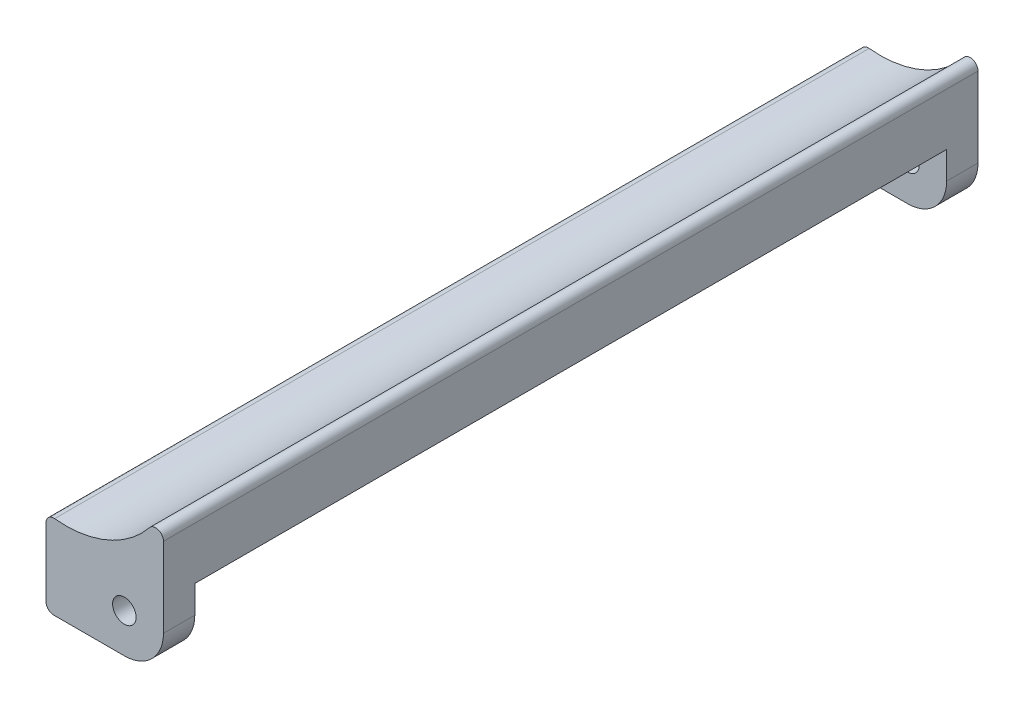
from build123d import *

# Parameters (mm, degrees)
EXTRUDE_1_DEPTH = 104
SKETCH_1_23_R   = 1.5
EXTRUDE_2_DEPTH = 4
EXTRUDE_START   = 100
SKETCH_1_24_R   = 1.5
EXTRUDE_3_DEPTH = 4
FILLET_1_R      = 1


with BuildPart() as part:
    # 草图1 → 凸台-拉伸1 (new body)
    with BuildSketch(Plane.XY):
        with BuildLine():
            Line((17.75, -10.5), (17.75, -0.328219619))
            ThreePointArc((17.75, -0.328219619), (11.588859881, -6.801694776), (2.75, -8.120817283))
            Line((2.75, -8.120817283), (2.75, -19))
            Line((2.75, -19), (9.25, -19))
            Line((9.25, -19), (9.25, -14))
            ThreePointArc((9.25, -14), (10.275126266, -11.525126266), (12.75, -10.5))
            Line((12.75, -10.5), (17.75, -10.5))
        make_face()
    extrude(amount=EXTRUDE_1_DEPTH)

    # 草图1<23> → 凸台-拉伸2 (add)
    with BuildSketch(Plane.XY):
        with BuildLine():
            Line((17.75, -14), (17.75, -10.5))
            Line((17.75, -10.5), (12.75, -10.5))
            ThreePointArc((12.75, -10.5), (10.275126266, -11.525126266), (9.25, -14))
            Line((9.25, -14), (9.25, -19))
            Line((9.25, -19), (12.75, -19))
            ThreePointArc((12.75, -19), (16.285533906, -17.535533906), (17.75, -14))
        make_face()
        with Locations((12.75, -14)):
            Circle(SKETCH_1_23_R, mode=Mode.SUBTRACT)
    extrude(amount=EXTRUDE_2_DEPTH)

    # 草图1<24> → 凸台-拉伸3 (add)
    with BuildSketch(Plane.XY.offset(EXTRUDE_START)):
        with BuildLine():
            Line((17.75, -14), (17.75, -10.5))
            Line((17.75, -10.5), (12.75, -10.5))
            ThreePointArc((12.75, -10.5), (10.275126266, -11.525126266), (9.25, -14))
            Line((9.25, -14), (9.25, -19))
            Line((9.25, -19), (12.75, -19))
            ThreePointArc((12.75, -19), (16.285533906, -17.535533906), (17.75, -14))
        make_face()
        with Locations((12.75, -14)):
            Circle(SKETCH_1_24_R, mode=Mode.SUBTRACT)
    extrude(amount=EXTRUDE_3_DEPTH)

    # 圆角1
    fillet_1_edges = [part.edges().sort_by_distance(p)[0] for p in [
        (2.75, -8.120817283, 52),
        (2.75, -19, 52),
        (17.75, -0.328219619, 52),
    ]]
    fillet(fillet_1_edges, radius=FILLET_1_R)


solid = part.part
